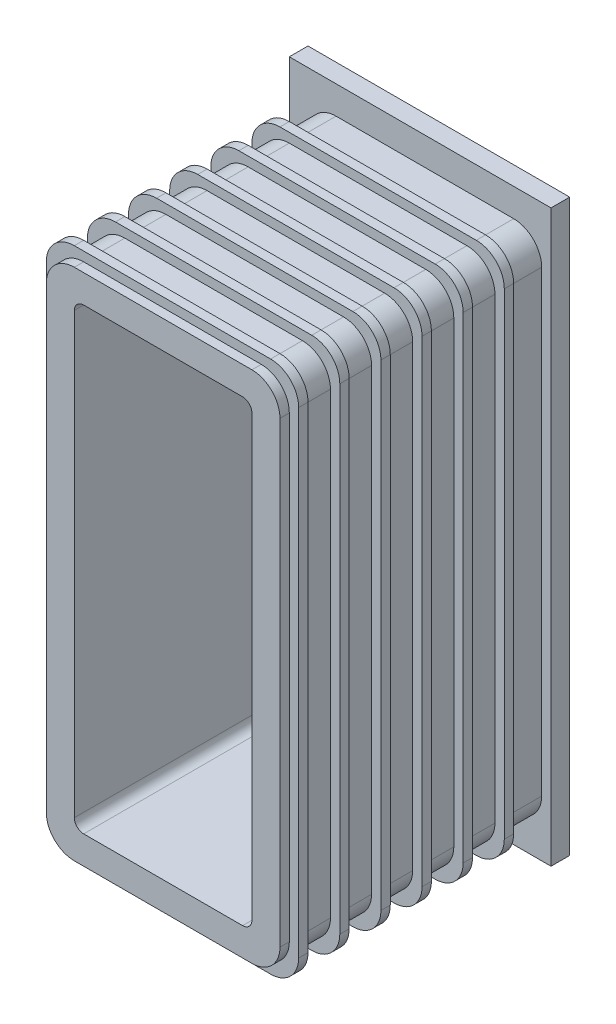
from build123d import *

# Parameters (mm, degrees)
SKETCH2_W           = 50
SKETCH2_H           = 225
SKETCH2_W_2         = 30
SKETCH2_H_2         = 205
BOSS_EXTRUDE1_DEPTH = 25
SKETCH3_W           = 140
SKETCH3_H           = 305
SKETCH3_W_2         = 30
SKETCH3_H_2         = 205
BOSS_EXTRUDE2_DEPTH = 10
BOSS_EXTRUDE3_DEPTH = 140
BOSS_EXTRUDE4_START = 20
BOSS_EXTRUDE4_DEPTH = 5
LPATTERN1_COUNT     = 6
LPATTERN1_PITCH     = 22


with BuildPart() as part:
    # Sketch2 → Boss-Extrude1 (new body)
    with BuildSketch(Plane.XY):
        Rectangle(SKETCH2_W, SKETCH2_H)
        Rectangle(SKETCH2_W_2, SKETCH2_H_2, mode=Mode.SUBTRACT)
    extrude(amount=-BOSS_EXTRUDE1_DEPTH)

    # Sketch3 → Boss-Extrude2 (add)
    with BuildSketch(Plane.XY):
        with Locations((15, 0)):
            Rectangle(SKETCH3_W, SKETCH3_H)
        Rectangle(SKETCH3_W_2, SKETCH3_H_2, mode=Mode.SUBTRACT)
    extrude(amount=BOSS_EXTRUDE2_DEPTH)

    # Sketch4 → Boss-Extrude3 (add)
    with BuildSketch(Plane.XY.offset(10)):
        with BuildLine():
            Line((-30, 137.5), (65, 137.5))
            ThreePointArc((65, 137.5), (75.606601718, 133.106601718), (80, 122.5))
            Line((80, 122.5), (80, -122.5))
            ThreePointArc((80, -122.5), (75.606601718, -133.106601718), (65, -137.5))
            Line((65, -137.5), (-30, -137.5))
            ThreePointArc((-30, -137.5), (-40.606601718, -133.106601718), (-45, -122.5))
            Line((-45, -122.5), (-45, 122.5))
            ThreePointArc((-45, 122.5), (-40.606601718, 133.106601718), (-30, 137.5))
        make_face()
        with BuildLine():
            Line((-25, 122.5), (60, 122.5))
            ThreePointArc((60, 122.5), (63.535533906, 121.035533906), (65, 117.5))
            Line((65, 117.5), (65, -117.5))
            ThreePointArc((65, -117.5), (63.535533906, -121.035533906), (60, -122.5))
            Line((60, -122.5), (-25, -122.5))
            ThreePointArc((-25, -122.5), (-28.535533906, -121.035533906), (-30, -117.5))
            Line((-30, -117.5), (-30, 117.5))
            ThreePointArc((-30, 117.5), (-28.535533906, 121.035533906), (-25, 122.5))
        make_face(mode=Mode.SUBTRACT)
    extrude(amount=BOSS_EXTRUDE3_DEPTH)

    # Sketch5 → Boss-Extrude4 (add)
    with BuildSketch(Plane.XY.offset(10).offset(BOSS_EXTRUDE4_START)):
        with BuildLine():
            Line((-35, 142.5), (70, 142.5))
            ThreePointArc((70, 142.5), (80.606601718, 138.106601718), (85, 127.5))
            Line((85, 127.5), (85, -127.5))
            ThreePointArc((85, -127.5), (80.606601718, -138.106601718), (70, -142.5))
            Line((70, -142.5), (-35, -142.5))
            ThreePointArc((-35, -142.5), (-45.606601718, -138.106601718), (-50, -127.5))
            Line((-50, -127.5), (-50, 127.5))
            ThreePointArc((-50, 127.5), (-45.606601718, 138.106601718), (-35, 142.5))
        make_face()
        with BuildLine():
            Line((-30, 137.5), (65, 137.5))
            ThreePointArc((65, 137.5), (75.606601718, 133.106601718), (80, 122.5))
            Line((80, 122.5), (80, -122.5))
            ThreePointArc((80, -122.5), (75.606601718, -133.106601718), (65, -137.5))
            Line((65, -137.5), (-30, -137.5))
            ThreePointArc((-30, -137.5), (-40.606601718, -133.106601718), (-45, -122.5))
            Line((-45, -122.5), (-45, 122.5))
            ThreePointArc((-45, 122.5), (-40.606601718, 133.106601718), (-30, 137.5))
        make_face(mode=Mode.SUBTRACT)
    boss_extrude4 = extrude(amount=BOSS_EXTRUDE4_DEPTH)

    # LPattern1: Boss-Extrude4 ×6
    with Locations(*[(0, 0, i * LPATTERN1_PITCH) for i in range(1, LPATTERN1_COUNT)]):
        add(boss_extrude4)


solid = part.part
